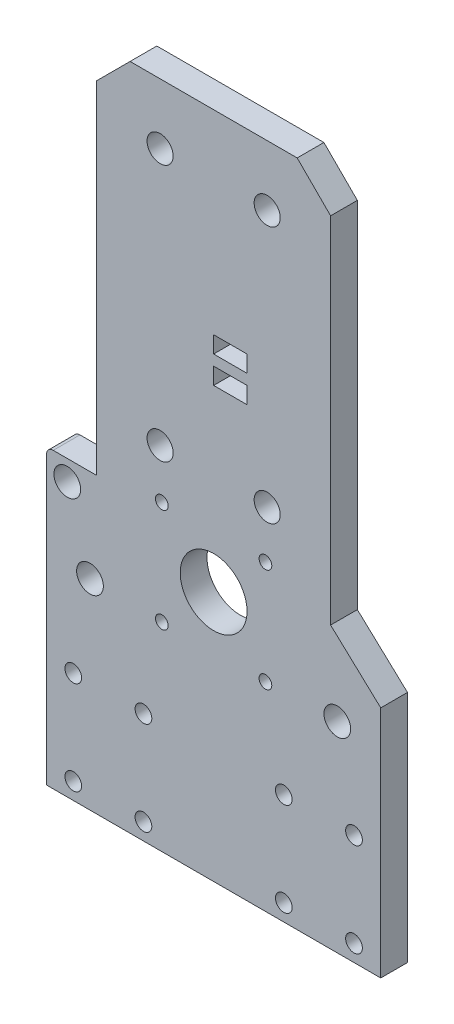
from build123d import *

# Parameters (mm, degrees)
SKETCH2_R           = 4
SKETCH2_R_2         = 10
SKETCH2_R_3         = 2.5
SKETCH2_R_4         = 3.9
SKETCH2_W           = 10
SKETCH2_H           = 5
BOSS_EXTRUDE2_DEPTH = 8
SKETCH3_R           = 1.9
CUT_EXTRUDE1_DEPTH  = 10
CHAMFER1_SIZE       = 10


with BuildPart() as part:
    # Sketch2 → Boss-Extrude2 (new body)
    with BuildSketch(Plane.XY):
        with BuildLine():
            Line((50, -44.865381447), (-50, -44.865381447))
            Line((-50, -44.865381447), (-50, 25.134618553))
            Line((-50, 25.134618553), (-50, 40.864537659))
            ThreePointArc((-50, 40.864537659), (-49.414213562, 42.278751221), (-48, 42.864537659))
            Line((-48, 42.864537659), (-35, 42.864537659))
            Line((-35, 42.864537659), (-35, 155.134618553))
            Line((-35, 155.134618553), (35, 155.134618553))
            Line((35, 155.134618553), (35, 39.08785688))
            Line((35, 39.08785688), (50, 25.134618553))
            Line((50, 25.134618553), (50, -44.865381447))
        make_face()
        with Locations((-37, 15.134618553)):
            Circle(SKETCH2_R, mode=Mode.SUBTRACT)
        with Locations((37, 15.134618553)):
            Circle(SKETCH2_R, mode=Mode.SUBTRACT)
        with Locations((0, 30.134618553)):
            Circle(SKETCH2_R_2, mode=Mode.SUBTRACT)
        with Locations((42, -39.865381447)):
            Circle(SKETCH2_R_3, mode=Mode.SUBTRACT)
        with Locations((21, -39.865381447)):
            Circle(SKETCH2_R_3, mode=Mode.SUBTRACT)
        with Locations((-43.787591992, 36.827877872)):
            Circle(SKETCH2_R, mode=Mode.SUBTRACT)
        with Locations((42, -11.865381447)):
            Circle(SKETCH2_R_3, mode=Mode.SUBTRACT)
        with Locations((21, -11.865381447)):
            Circle(SKETCH2_R_3, mode=Mode.SUBTRACT)
        with Locations((-21, -11.865381447)):
            Circle(SKETCH2_R_3, mode=Mode.SUBTRACT)
        with Locations((-42, -11.865381447)):
            Circle(SKETCH2_R_3, mode=Mode.SUBTRACT)
        with Locations((-21, -39.865381447)):
            Circle(SKETCH2_R_3, mode=Mode.SUBTRACT)
        with Locations((-42, -39.865381447)):
            Circle(SKETCH2_R_3, mode=Mode.SUBTRACT)
        with Locations((-16.01970462, 60.134618553)):
            Circle(SKETCH2_R_4, mode=Mode.SUBTRACT)
        with Locations((16.019778849, 60.134618553)):
            Circle(SKETCH2_R_4, mode=Mode.SUBTRACT)
        with Locations((-16.01970462, 137.048261945)):
            Circle(SKETCH2_R_4, mode=Mode.SUBTRACT)
        with Locations((16.019778849, 137.048261945)):
            Circle(SKETCH2_R_4, mode=Mode.SUBTRACT)
        with Locations((5, 86.183799898)):
            Rectangle(SKETCH2_W, SKETCH2_H, mode=Mode.SUBTRACT)
        with Locations((5, 94.319599175)):
            Rectangle(SKETCH2_W, SKETCH2_H, mode=Mode.SUBTRACT)
    extrude(amount=BOSS_EXTRUDE2_DEPTH)

    # Sketch3 → Cut-Extrude1 (cut)
    with BuildSketch(Plane.XY.offset(8)):
        with Locations((-15.5, 14.634618553)):
            Circle(SKETCH3_R)
        with Locations((-15.5, 45.634618553)):
            Circle(SKETCH3_R)
        with Locations((15.5, 45.634618553)):
            Circle(SKETCH3_R)
        with Locations((15.5, 14.634618553)):
            Circle(SKETCH3_R)
    extrude(amount=-CUT_EXTRUDE1_DEPTH, mode=Mode.SUBTRACT)

    # Chamfer1
    chamfer1_edges = [part.edges().sort_by_distance(p)[0] for p in [
        (35, 155.134618553, 4),
        (-35, 155.134618553, 4),
    ]]
    chamfer(chamfer1_edges, length=CHAMFER1_SIZE)


solid = part.part
